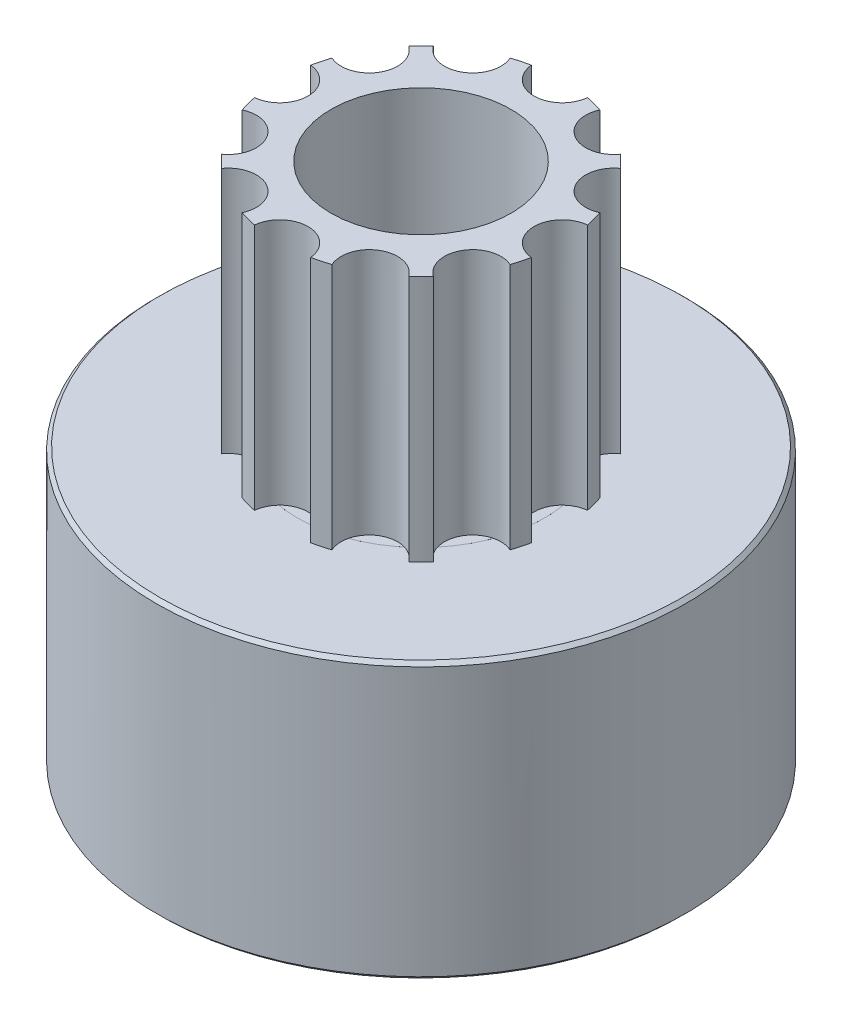
from build123d import *
from build123d.topology import SkipClean

# Parameters (mm, degrees)
P_IDAT_START            = 7.8
SKICA1_R                = 2.5
P_IDAT_VYSUNUT_M1_DEPTH = 7
SKICA2_R                = 3.5
SKICA2_R_2              = 2.5
P_IDAT_VYSUNUT_M2_DEPTH = 7.8
SKICA6_R                = 7.5
SKICA6_R_2              = 3.5
P_IDAT_VYSUNUT_M5_DEPTH = 7.8
ZKOSEN_3_SIZE           = 0.1
SKETCH19_R              = 1.5
CUT_EXTRUDE6_DEPTH      = 8
SKETCH20_R              = 1.5
CUT_EXTRUDE7_DEPTH      = 8
SKETCH21_R              = 2.55
CUT_EXTRUDE8_DEPTH      = 30
SKETCH22_R              = 8.432863054
CUT_EXTRUDE10_DEPTH     = 7
CUT_EXTRUDE13_DEPTH     = 7


with BuildPart() as part:
    # Skica1 → Přidat vysunutím1 (new body)
    with BuildSketch(Plane(origin=(0, 0, 0), x_dir=(1, 0, 0), z_dir=(0, 1, 0)).offset(P_IDAT_START)):
        with BuildLine():
            ThreePointArc((-5.730143195, 1.098270155), (-5.09645097, 1.530497044), (-5.387174672, 2.240331989))
            ThreePointArc((-5.387174672, 2.240331989), (-5.468060657, 2.292707421), (-5.540463547, 2.356296335))
            ThreePointArc((-5.540463547, 2.356296335), (-5.573874331, 2.399596558), (-5.596043873, 2.44959357))
            ThreePointArc((-5.596043873, 2.44959357), (-5.50369925, 2.650567912), (-5.404139771, 2.848067596))
            ThreePointArc((-5.404139771, 2.848067596), (-5.351227535, 2.86190541), (-5.296542742, 2.862779021))
            ThreePointArc((-5.296542742, 2.862779021), (-5.201685094, 2.845815675), (-5.110305882, 2.815228615))
            ThreePointArc((-5.110305882, 2.815228615), (-4.374063308, 3.030479148), (-4.431206919, 3.795410862))
            ThreePointArc((-4.431206919, 3.795410862), (-4.491949163, 3.870218002), (-4.541158349, 3.953068377))
            ThreePointArc((-4.541158349, 3.953068377), (-4.559553388, 4.004573836), (-4.565187949, 4.058974585))
            ThreePointArc((-4.565187949, 4.058974585), (-4.415258506, 4.221576484), (-4.259541056, 4.378644275))
            ThreePointArc((-4.259541056, 4.378644275), (-4.204942409, 4.375454038), (-4.15266412, 4.359386362))
            ThreePointArc((-4.15266412, 4.359386362), (-4.067691098, 4.313940635), (-3.990236225, 4.256612884))
            ThreePointArc((-3.990236225, 4.256612884), (-3.223511854, 4.233816838), (-3.041481758, 4.978968476))
            ThreePointArc((-3.041481758, 4.978968476), (-3.076134388, 5.06888468), (-3.097332931, 5.162886543))
            ThreePointArc((-3.097332931, 5.162886543), (-3.09891159, 5.217555525), (-3.08745962, 5.271034888))
            ThreePointArc((-3.08745962, 5.271034888), (-2.894621497, 5.379347737), (-2.697988784, 5.480608745))
            ThreePointArc((-2.697988784, 5.480608745), (-2.647048223, 5.460702739), (-2.6022938, 5.429266591))
            ThreePointArc((-2.6022938, 5.429266591), (-2.535523156, 5.359787029), (-2.479574443, 5.281330225))
            ThreePointArc((-2.479574443, 5.281330225), (-1.7574206, 5.022719037), (-1.354035171, 5.675149965))
            ThreePointArc((-1.354035171, 5.675149965), (-1.359206146, 5.771373608), (-1.350318985, 5.867325402))
            ThreePointArc((-1.350318985, 5.867325402), (-1.334926735, 5.919806527), (-1.307509232, 5.967129569))
            ThreePointArc((-1.307509232, 5.967129569), (-1.090638767, 6.010550954), (-0.872338572, 6.046093045))
            ThreePointArc((-0.872338572, 6.046093045), (-0.830042514, 6.01141981), (-0.797192832, 5.967692379))
            ThreePointArc((-0.797192832, 5.967692379), (-0.755160541, 5.880980125), (-0.726194639, 5.789074167))
            ThreePointArc((-0.726194639, 5.789074167), (-0.119300773, 5.319962501), (0.465953812, 5.815808234))
            ThreePointArc((0.465953812, 5.815808234), (0.490770664, 5.908920276), (0.528873591, 5.997429571))
            ThreePointArc((0.528873591, 5.997429571), (0.55973005, 6.04258562), (0.600429269, 6.079120034))
            ThreePointArc((0.600429269, 6.079120034), (0.820103284, 6.053399565), (1.038702217, 6.019743632))
            ThreePointArc((1.038702217, 6.019743632), (1.06821354, 5.973697225), (1.085942924, 5.921958857))
            ThreePointArc((1.085942924, 5.921958857), (1.099122448, 5.826501911), (1.098270155, 5.730143195))
            ThreePointArc((1.098270155, 5.730143195), (1.530497044, 5.09645097), (2.240331989, 5.387174672))
            ThreePointArc((2.240331989, 5.387174672), (2.292707421, 5.468060657), (2.356296335, 5.540463547))
            ThreePointArc((2.356296335, 5.540463547), (2.399596558, 5.573874331), (2.44959357, 5.596043873))
            ThreePointArc((2.44959357, 5.596043873), (2.650567912, 5.50369925), (2.848067596, 5.404139771))
            ThreePointArc((2.848067596, 5.404139771), (2.86190541, 5.351227535), (2.862779021, 5.296542742))
            ThreePointArc((2.862779021, 5.296542742), (2.845815675, 5.201685094), (2.815228615, 5.110305882))
            ThreePointArc((2.815228615, 5.110305882), (3.030479148, 4.374063308), (3.795410862, 4.431206919))
            ThreePointArc((3.795410862, 4.431206919), (3.870218002, 4.491949163), (3.953068377, 4.541158349))
            ThreePointArc((3.953068377, 4.541158349), (4.004573836, 4.559553388), (4.058974585, 4.565187949))
            ThreePointArc((4.058974585, 4.565187949), (4.221576484, 4.415258506), (4.378644275, 4.259541056))
            ThreePointArc((4.378644275, 4.259541056), (4.375454038, 4.204942409), (4.359386362, 4.15266412))
            ThreePointArc((4.359386362, 4.15266412), (4.313940635, 4.067691098), (4.256612884, 3.990236225))
            ThreePointArc((4.256612884, 3.990236225), (4.233816838, 3.223511854), (4.978968476, 3.041481758))
            ThreePointArc((4.978968476, 3.041481758), (5.06888468, 3.076134388), (5.162886543, 3.097332931))
            ThreePointArc((5.162886543, 3.097332931), (5.217555525, 3.09891159), (5.271034888, 3.08745962))
            ThreePointArc((5.271034888, 3.08745962), (5.379347737, 2.894621497), (5.480608745, 2.697988784))
            ThreePointArc((5.480608745, 2.697988784), (5.460702739, 2.647048223), (5.429266591, 2.6022938))
            ThreePointArc((5.429266591, 2.6022938), (5.359787029, 2.535523156), (5.281330225, 2.479574443))
            ThreePointArc((5.281330225, 2.479574443), (5.022719037, 1.7574206), (5.675149965, 1.354035171))
            ThreePointArc((5.675149965, 1.354035171), (5.771373608, 1.359206146), (5.867325402, 1.350318985))
            ThreePointArc((5.867325402, 1.350318985), (5.919806527, 1.334926735), (5.967129569, 1.307509232))
            ThreePointArc((5.967129569, 1.307509232), (6.010550954, 1.090638767), (6.046093045, 0.872338572))
            ThreePointArc((6.046093045, 0.872338572), (6.01141981, 0.830042514), (5.967692379, 0.797192832))
            ThreePointArc((5.967692379, 0.797192832), (5.880980125, 0.755160541), (5.789074167, 0.726194639))
            ThreePointArc((5.789074167, 0.726194639), (5.319962501, 0.119300773), (5.815808234, -0.465953812))
            ThreePointArc((5.815808234, -0.465953812), (5.908920276, -0.490770664), (5.997429571, -0.528873591))
            ThreePointArc((5.997429571, -0.528873591), (6.04258562, -0.55973005), (6.079120034, -0.600429269))
            ThreePointArc((6.079120034, -0.600429269), (6.053399565, -0.820103284), (6.019743632, -1.038702217))
            ThreePointArc((6.019743632, -1.038702217), (5.973697225, -1.06821354), (5.921958857, -1.085942924))
            ThreePointArc((5.921958857, -1.085942924), (5.826501911, -1.099122448), (5.730143195, -1.098270155))
            ThreePointArc((5.730143195, -1.098270155), (5.09645097, -1.530497044), (5.387174672, -2.240331989))
            ThreePointArc((5.387174672, -2.240331989), (5.468060657, -2.292707421), (5.540463547, -2.356296335))
            ThreePointArc((5.540463547, -2.356296335), (5.573874331, -2.399596558), (5.596043873, -2.44959357))
            ThreePointArc((5.596043873, -2.44959357), (5.50369925, -2.650567911), (5.404139771, -2.848067596))
            ThreePointArc((5.404139771, -2.848067596), (5.351227535, -2.86190541), (5.296542742, -2.862779021))
            ThreePointArc((5.296542742, -2.862779021), (5.201685094, -2.845815675), (5.110305882, -2.815228615))
            ThreePointArc((5.110305882, -2.815228615), (4.374063308, -3.030479148), (4.431206919, -3.795410862))
            ThreePointArc((4.431206919, -3.795410862), (4.491949163, -3.870218002), (4.541158349, -3.953068377))
            ThreePointArc((4.541158349, -3.953068377), (4.559553388, -4.004573836), (4.565187949, -4.058974585))
            ThreePointArc((4.565187949, -4.058974585), (4.415258506, -4.221576484), (4.259541056, -4.378644275))
            ThreePointArc((4.259541056, -4.378644275), (4.204942409, -4.375454038), (4.15266412, -4.359386362))
            ThreePointArc((4.15266412, -4.359386362), (4.067691098, -4.313940635), (3.990236225, -4.256612884))
            ThreePointArc((3.990236225, -4.256612884), (3.223511854, -4.233816838), (3.041481758, -4.978968476))
            ThreePointArc((3.041481758, -4.978968476), (3.076134388, -5.06888468), (3.097332931, -5.162886543))
            ThreePointArc((3.097332931, -5.162886543), (3.09891159, -5.217555525), (3.08745962, -5.271034888))
            ThreePointArc((3.08745962, -5.271034888), (2.894621497, -5.379347737), (2.697988784, -5.480608745))
            ThreePointArc((2.697988784, -5.480608745), (2.647048223, -5.460702739), (2.6022938, -5.429266591))
            ThreePointArc((2.6022938, -5.429266591), (2.535523156, -5.359787029), (2.479574443, -5.281330225))
            ThreePointArc((2.479574443, -5.281330225), (1.7574206, -5.022719037), (1.354035171, -5.675149965))
            ThreePointArc((1.354035171, -5.675149965), (1.359206146, -5.771373608), (1.350318985, -5.867325402))
            ThreePointArc((1.350318985, -5.867325402), (1.334926735, -5.919806527), (1.307509232, -5.967129569))
            ThreePointArc((1.307509232, -5.967129569), (1.090638767, -6.010550954), (0.872338572, -6.046093045))
            ThreePointArc((0.872338572, -6.046093045), (0.830042514, -6.01141981), (0.797192832, -5.967692379))
            ThreePointArc((0.797192832, -5.967692379), (0.755160541, -5.880980125), (0.726194639, -5.789074167))
            ThreePointArc((0.726194639, -5.789074167), (0.119300773, -5.319962501), (-0.465953812, -5.815808234))
            ThreePointArc((-0.465953812, -5.815808234), (-0.490770664, -5.908920276), (-0.528873591, -5.997429571))
            ThreePointArc((-0.528873591, -5.997429571), (-0.55973005, -6.04258562), (-0.600429269, -6.079120034))
            ThreePointArc((-0.600429269, -6.079120034), (-0.820103284, -6.053399565), (-1.038702217, -6.019743632))
            ThreePointArc((-1.038702217, -6.019743632), (-1.06821354, -5.973697225), (-1.085942924, -5.921958857))
            ThreePointArc((-1.085942924, -5.921958857), (-1.099122448, -5.826501911), (-1.098270155, -5.730143195))
            ThreePointArc((-1.098270155, -5.730143195), (-1.530497044, -5.09645097), (-2.240331989, -5.387174672))
            ThreePointArc((-2.240331989, -5.387174672), (-2.292707421, -5.468060657), (-2.356296335, -5.540463547))
            ThreePointArc((-2.356296335, -5.540463547), (-2.399596558, -5.573874331), (-2.44959357, -5.596043873))
            ThreePointArc((-2.44959357, -5.596043873), (-2.650567912, -5.50369925), (-2.848067596, -5.404139771))
            ThreePointArc((-2.848067596, -5.404139771), (-2.86190541, -5.351227535), (-2.862779021, -5.296542742))
            ThreePointArc((-2.862779021, -5.296542742), (-2.845815675, -5.201685094), (-2.815228615, -5.110305882))
            ThreePointArc((-2.815228615, -5.110305882), (-3.030479148, -4.374063308), (-3.795410862, -4.431206919))
            ThreePointArc((-3.795410862, -4.431206919), (-3.870218002, -4.491949163), (-3.953068377, -4.541158349))
            ThreePointArc((-3.953068377, -4.541158349), (-4.004573836, -4.559553388), (-4.058974585, -4.565187949))
            ThreePointArc((-4.058974585, -4.565187949), (-4.221576484, -4.415258506), (-4.378644275, -4.259541056))
            ThreePointArc((-4.378644275, -4.259541056), (-4.375454038, -4.204942409), (-4.359386362, -4.15266412))
            ThreePointArc((-4.359386362, -4.15266412), (-4.313940635, -4.067691098), (-4.256612884, -3.990236225))
            ThreePointArc((-4.256612884, -3.990236225), (-4.233816838, -3.223511854), (-4.978968476, -3.041481758))
            ThreePointArc((-4.978968476, -3.041481758), (-5.06888468, -3.076134388), (-5.162886543, -3.097332931))
            ThreePointArc((-5.162886543, -3.097332931), (-5.217555525, -3.09891159), (-5.271034888, -3.08745962))
            ThreePointArc((-5.271034888, -3.08745962), (-5.379347737, -2.894621497), (-5.480608745, -2.697988784))
            ThreePointArc((-5.480608745, -2.697988784), (-5.460702739, -2.647048223), (-5.429266591, -2.6022938))
            ThreePointArc((-5.429266591, -2.6022938), (-5.359787029, -2.535523156), (-5.281330225, -2.479574443))
            ThreePointArc((-5.281330225, -2.479574443), (-5.022719037, -1.7574206), (-5.675149965, -1.354035171))
            ThreePointArc((-5.675149965, -1.354035171), (-5.771373608, -1.359206146), (-5.867325402, -1.350318985))
            ThreePointArc((-5.867325402, -1.350318985), (-5.919806527, -1.334926735), (-5.967129569, -1.307509232))
            ThreePointArc((-5.967129569, -1.307509232), (-6.010550954, -1.090638767), (-6.046093045, -0.872338572))
            ThreePointArc((-6.046093045, -0.872338572), (-6.01141981, -0.830042514), (-5.967692379, -0.797192832))
            ThreePointArc((-5.967692379, -0.797192832), (-5.880980125, -0.755160541), (-5.789074167, -0.726194639))
            ThreePointArc((-5.789074167, -0.726194639), (-5.319962501, -0.119300773), (-5.815808234, 0.465953812))
            ThreePointArc((-5.815808234, 0.465953812), (-5.908920276, 0.490770664), (-5.997429571, 0.528873591))
            ThreePointArc((-5.997429571, 0.528873591), (-6.04258562, 0.55973005), (-6.079120034, 0.600429269))
            ThreePointArc((-6.079120034, 0.600429269), (-6.053399565, 0.820103284), (-6.019743632, 1.038702217))
            ThreePointArc((-6.019743632, 1.038702217), (-5.973697225, 1.06821354), (-5.921958857, 1.085942924))
            ThreePointArc((-5.921958857, 1.085942924), (-5.826501911, 1.099122448), (-5.730143195, 1.098270155))
        make_face()
        with Locations(Location((0, 0, 0), (0, 0, 270))):
            Circle(SKICA1_R, mode=Mode.SUBTRACT)
    extrude(amount=P_IDAT_VYSUNUT_M1_DEPTH)

    # Skica2 → Přidat vysunutím2 (add)
    with SkipClean():  # the faces are left unmerged after this step: merging them gives an invalid solid
        with BuildSketch(Plane.XZ.offset(-7.8).offset(P_IDAT_START)):
            with Locations(Location((0, 0, 0), (0, 0, 90))):
                Circle(SKICA2_R)
            with Locations(Location((0, 0, 0), (0, 0, 270))):
                Circle(SKICA2_R_2, mode=Mode.SUBTRACT)
        extrude(amount=-P_IDAT_VYSUNUT_M2_DEPTH)


with BuildPart() as body_2:
    # Skica6 → Přidat vysunutím5 (new body)
    with BuildSketch(Plane.XZ):
        with Locations(Location((0, 0, 0), (0, 0, 270))):
            Circle(SKICA6_R)
        with Locations(Location((0, 0, 0), (0, 0, 270))):
            Circle(SKICA6_R_2, mode=Mode.SUBTRACT)
    extrude(amount=-P_IDAT_VYSUNUT_M5_DEPTH)

    # Zkosení3
    zkosen_3_edges = [body_2.edges().sort_by_distance(p)[0] for p in [
        (0, 0, 7.5),
        (0, 7.8, 7.5),
    ]]
    chamfer(zkosen_3_edges, length=ZKOSEN_3_SIZE)


with BuildPart() as cut_extrude6_tool:
    # Sketch19 → Cut-Extrude6 (new body)
    with SkipClean():  # the faces are left unmerged after this step: merging them gives an invalid solid
        with BuildSketch(Plane(origin=(0, 0, -7.5), x_dir=(-1, 0, 0), z_dir=(0, 0, -1))):
            with Locations(Location((0, 3.9, 0), (0, 0, 90))):
                Circle(SKETCH19_R)
        extrude(amount=-CUT_EXTRUDE6_DEPTH)


with BuildPart() as part_1:
    with SkipClean():  # the faces are left unmerged after this step: merging them gives an invalid solid
        add(part.part)

        # Cut-Extrude6: cut by cut_extrude6_tool
        add(cut_extrude6_tool.part, mode=Mode.SUBTRACT)


with BuildPart() as body_2_1:
    with SkipClean():  # the faces are left unmerged after this step: merging them gives an invalid solid
        add(body_2.part)

        # Cut-Extrude6: cut by cut_extrude6_tool
        add(cut_extrude6_tool.part, mode=Mode.SUBTRACT)


with BuildPart() as cut_extrude7_tool:
    # Sketch20 → Cut-Extrude7 (new body)
    with SkipClean():  # the faces are left unmerged after this step: merging them gives an invalid solid
        with BuildSketch(Plane.ZY.offset(7.5)):
            with Locations((0, 3.9)):
                Circle(SKETCH20_R)
        extrude(amount=-CUT_EXTRUDE7_DEPTH)


with BuildPart() as part_2:
    with SkipClean():  # the faces are left unmerged after this step: merging them gives an invalid solid
        add(part_1.part)

        # Cut-Extrude7: cut by cut_extrude7_tool
        add(cut_extrude7_tool.part, mode=Mode.SUBTRACT)

    # Sketch21 → Cut-Extrude8 (cut)
    with BuildSketch(Plane(origin=(0, 16, 0), x_dir=(1, 0, 0), z_dir=(0, 1, 0))):
        with Locations(Location((0, 0, 0), (0, 0, 270))):
            Circle(SKETCH21_R)
    extrude(amount=-CUT_EXTRUDE8_DEPTH, mode=Mode.SUBTRACT)

    # Sketch22 → Cut-Extrude10 (cut)
    with BuildSketch(Plane(origin=(0, 14.8, 0), x_dir=(1, 0, 0), z_dir=(0, 1, 0))):
        with Locations((0.638915894, -0.477145838)):
            Circle(SKETCH22_R)
        with BuildLine():
            ThreePointArc((3.792814558, -1.270652482), (3.863703305, -1.03527618), (3.92, -0.79598995))
            ThreePointArc((3.92, -0.79598995), (3.2, 0), (3.92, 0.79598995))
            ThreePointArc((3.92, 0.79598995), (3.863703305, 1.03527618), (3.792814558, 1.270652482))
            ThreePointArc((3.792814558, 1.270652482), (2.771281292, 1.6), (2.996824608, 2.649347518))
            ThreePointArc((2.996824608, 2.649347518), (2, 3.464101615), (0.79598995, 3.92))
            ThreePointArc((0.79598995, 3.92), (0, 3.2), (-0.79598995, 3.92))
            ThreePointArc((-0.79598995, 3.92), (-1.03527618, 3.863703305), (-1.270652482, 3.792814558))
            ThreePointArc((-1.270652482, 3.792814558), (-1.6, 2.771281292), (-2.649347518, 2.996824608))
            ThreePointArc((-2.649347518, 2.996824608), (-2.828427125, 2.828427125), (-2.996824608, 2.649347518))
            ThreePointArc((-2.996824608, 2.649347518), (-2.771281292, 1.6), (-3.792814558, 1.270652482))
            ThreePointArc((-3.792814558, 1.270652482), (-3.863703305, 1.03527618), (-3.92, 0.79598995))
            ThreePointArc((-3.92, 0.79598995), (-3.2, 0), (-3.92, -0.79598995))
            ThreePointArc((-3.92, -0.79598995), (-3.863703305, -1.03527618), (-3.792814558, -1.270652482))
            ThreePointArc((-3.792814558, -1.270652482), (-2.771281292, -1.6), (-2.996824608, -2.649347518))
            ThreePointArc((-2.996824608, -2.649347518), (-2.828427125, -2.828427125), (-2.649347518, -2.996824608))
            ThreePointArc((-2.649347518, -2.996824608), (-1.6, -2.771281292), (-1.270652482, -3.792814558))
            ThreePointArc((-1.270652482, -3.792814558), (-1.03527618, -3.863703305), (-0.79598995, -3.92))
            ThreePointArc((-0.79598995, -3.92), (0, -3.2), (0.79598995, -3.92))
            ThreePointArc((0.79598995, -3.92), (1.03527618, -3.863703305), (1.270652482, -3.792814558))
            ThreePointArc((1.270652482, -3.792814558), (1.6, -2.771281292), (2.649347518, -2.996824608))
            ThreePointArc((2.649347518, -2.996824608), (2.828427125, -2.828427125), (2.996824608, -2.649347518))
            ThreePointArc((2.996824608, -2.649347518), (2.771281292, -1.6), (3.792814558, -1.270652482))
        make_face(mode=Mode.SUBTRACT)
    extrude(amount=-CUT_EXTRUDE10_DEPTH, mode=Mode.SUBTRACT)

    # Sketch23 → Cut-Extrude13 (cut)
    with BuildSketch(Plane(origin=(0, 14.8, 0), x_dir=(1, 0, 0), z_dir=(0, 1, 0))):
        with BuildLine():
            ThreePointArc((1.270652482, 3.792814558), (1.238594058, 3.218620474), (1.599999992, 2.771281297))
            ThreePointArc((1.599999992, 2.771281297), (2.168110058, 2.681964154), (2.649347518, 2.996824608))
            ThreePointArc((2.649347518, 2.996824608), (2, 3.464101615), (1.270652482, 3.792814558))
        make_face()
        with BuildLine():
            ThreePointArc((2.8, 3.464101615), (2.168110062, 4.246239076), (1.270652482, 3.792814558))
            ThreePointArc((1.270652482, 3.792814558), (2, 3.464101615), (2.649347518, 2.996824608))
            ThreePointArc((2.649347518, 2.996824608), (2.761405941, 3.218620469), (2.8, 3.464101615))
        make_face()
    extrude(amount=-CUT_EXTRUDE13_DEPTH, mode=Mode.SUBTRACT)


with BuildPart() as body_2_2:
    with SkipClean():  # the faces are left unmerged after this step: merging them gives an invalid solid
        add(body_2_1.part)

        # Cut-Extrude7: cut by cut_extrude7_tool
        add(cut_extrude7_tool.part, mode=Mode.SUBTRACT)


solid = Compound([part_2.part, body_2_2.part])
